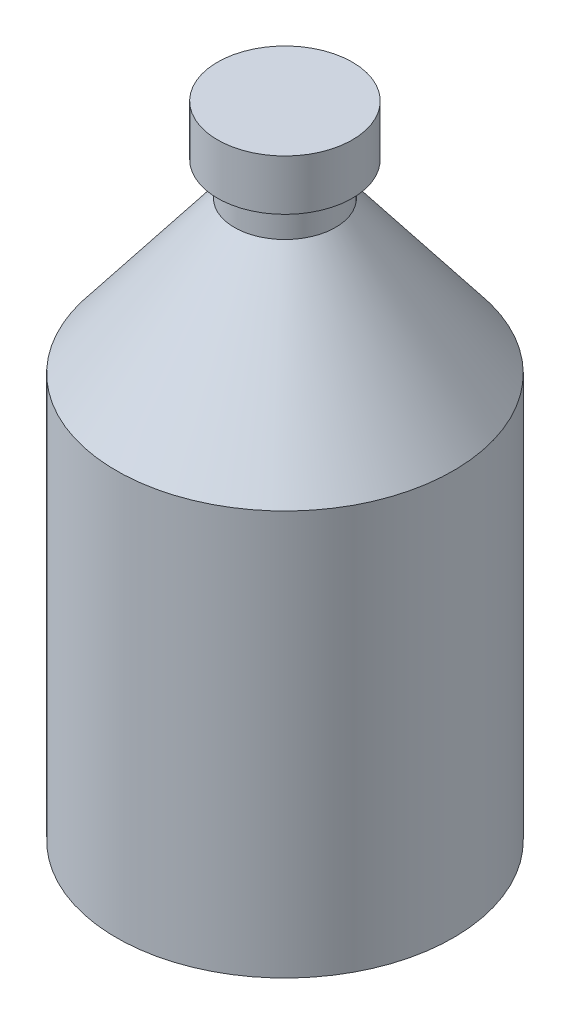
from build123d import *


with BuildPart() as part:
    # Sketch2 → Revolve1 (revolve)
    with BuildSketch(Plane(origin=(0, 0, 0), x_dir=(0, 0, -1), z_dir=(1, 0, 0))):
        Polygon((0, 0), (0, 120.65), (12.7, 120.65), (12.7, 111.125), (9.525, 111.125), (9.525, 104.775), (31.75, 76.2), (31.75, 0), align=None)
    revolve(axis=Axis((0, 0, 0), (0, 1, 0)))


solid = part.part
